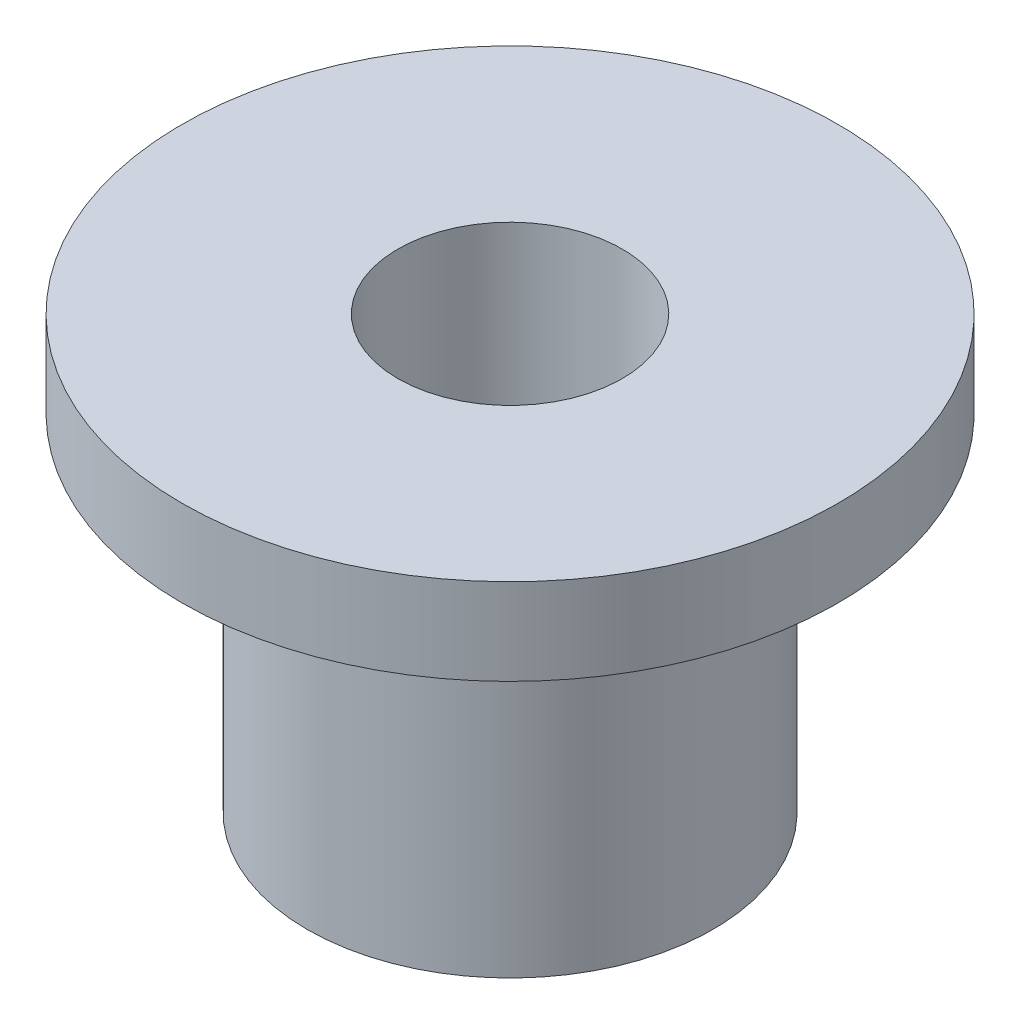
from build123d import *


with BuildPart() as part:
    # Sketch1 → Revolve1 (revolve)
    with BuildSketch(Plane.XY, mode=Mode.PRIVATE) as revolve1_sk:
        Polygon((-2.6, 0), (-2.6, 10), (-7.6, 10), (-7.6, 8), (-4.7, 8), (-4.7, 0), align=None)
    revolve(revolve1_sk.sketch.rotate(Axis((0, 5.173411558, 0), (0, -1, 0)), 270), axis=Axis((0, 5.173411558, 0), (0, -1, 0)))


solid = part.part
